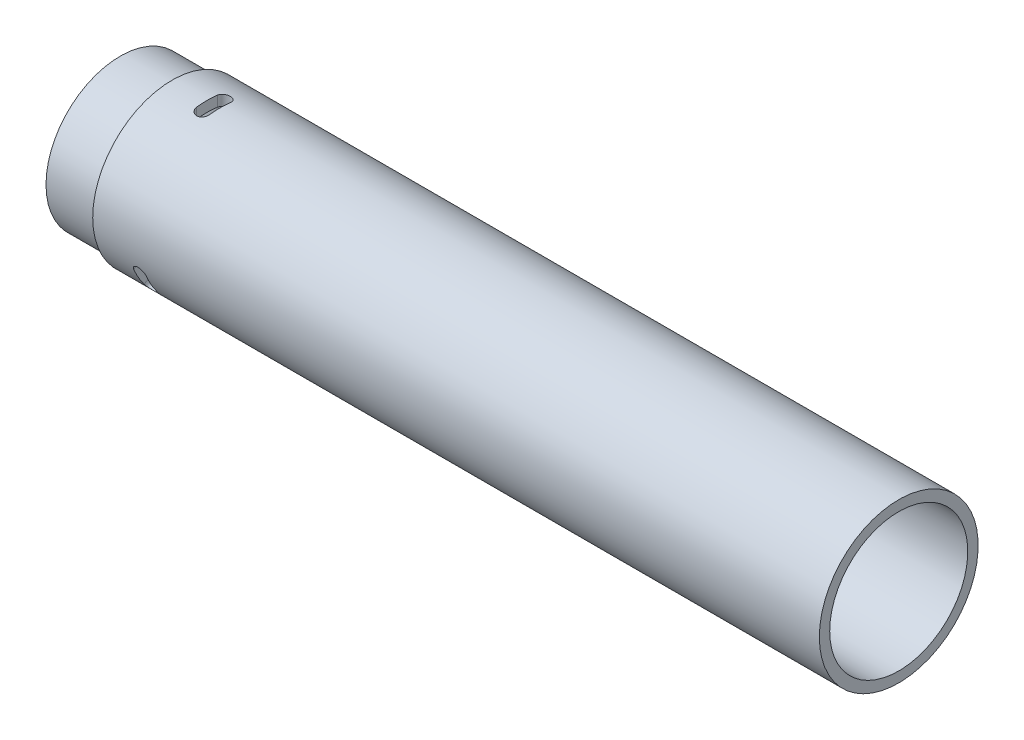
from build123d import *

# Parameters (mm, degrees)
CUT_EXTRUDE1_DEPTH = 7.62
CIRPATTERN1_COUNT  = 3


with BuildPart() as part:
    # Sketch1 → Revolve1 (revolve)
    with BuildSketch(Plane.XY, mode=Mode.PRIVATE) as revolve1_sk:
        Polygon((15.248535153, 18.161), (2.548535153, 18.161), (2.548535153, 16.891), (193.048535153, 16.891), (193.048535153, 19.431), (15.248535153, 19.431), align=None)
    revolve(revolve1_sk.sketch.rotate(Axis((0, 0, 0), (1, 0, 0)), 90), axis=Axis((0, 0, 0), (1, 0, 0)))

    # Sketch2 → Cut-Extrude1 (cut)
    with BuildSketch(Plane(origin=(0, 19.431, 0), x_dir=(1, 0, 0), z_dir=(0, 1, 0))):
        with BuildLine():
            Line((26.9875, 2.54), (26.9875, -2.54))
            ThreePointArc((26.9875, -2.54), (25.4, -4.1275), (23.8125, -2.54))
            Line((23.8125, -2.54), (23.8125, 2.54))
            ThreePointArc((23.8125, 2.54), (25.4, 4.1275), (26.9875, 2.54))
        make_face()
    cut_extrude1 = extrude(amount=-CUT_EXTRUDE1_DEPTH, mode=Mode.SUBTRACT)

    # CirPattern1: Cut-Extrude1 ×3 about axis
    cirpattern1_axis = Axis((0, 0, 0), (-1, 0, 0))
    for i in range(1, CIRPATTERN1_COUNT):
        add(cut_extrude1.rotate(cirpattern1_axis, i * 360 / CIRPATTERN1_COUNT), mode=Mode.SUBTRACT)


solid = part.part
